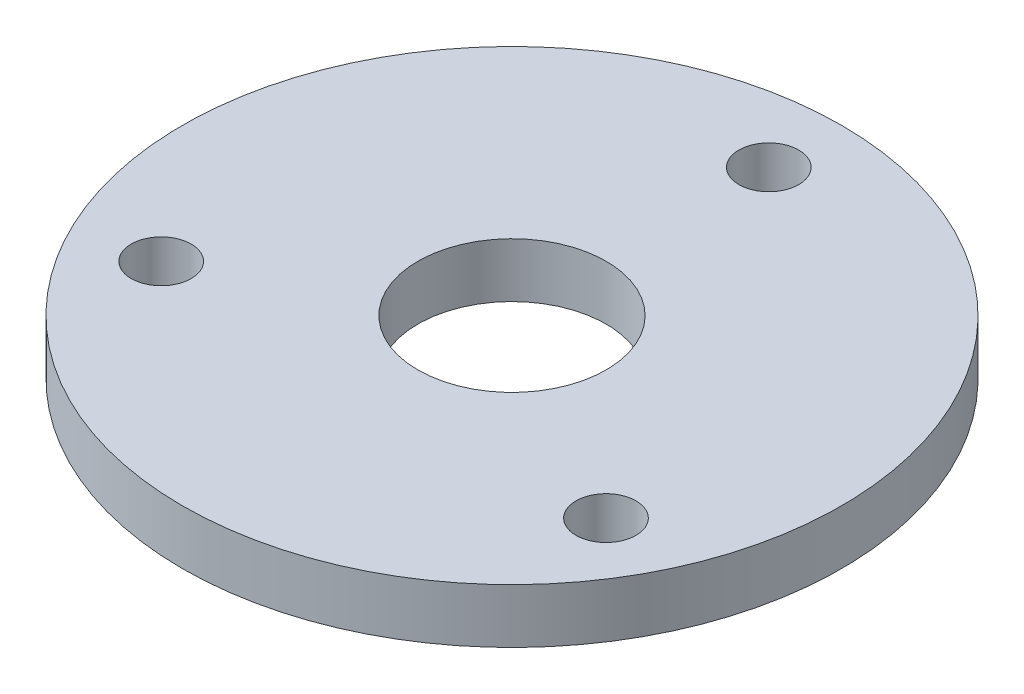
from build123d import *

# Parameters (mm, degrees)
SKETCH5_R           = 38.5
BOSS_EXTRUDE2_DEPTH = 6.36
SKETCH7_R           = 3.5
CUT_EXTRUDE3_DEPTH  = 1086.328407818
SKETCH8_R           = 11
CUT_EXTRUDE4_DEPTH  = 1086.328407818


with BuildPart() as part:
    # Sketch5 → Boss-Extrude2 (new body)
    with BuildSketch(Plane(origin=(0, 0, 0), x_dir=(1, 0, 0), z_dir=(0, 1, 0))):
        with Locations(Location((933.152542373, 445.016949153, 0), (0, 0, 90))):
            Circle(SKETCH5_R)
    extrude(amount=BOSS_EXTRUDE2_DEPTH)

    # Sketch7 → Cut-Extrude3 (cut, through all)
    with BuildSketch(Plane(origin=(0, 6.36, 0), x_dir=(1, 0, 0), z_dir=(0, 1, 0))):
        with Locations(Location((933.152542373, 475.016949153, 0), (0, 0, 270))):
            Circle(SKETCH7_R)
        with Locations((-55.199525992, -1045.642281877)):
            Circle(SKETCH7_R)
        with Locations((-877.953016381, 570.625332725)):
            Circle(SKETCH7_R)
        with Locations(Location((959.133304486, 430.016949153, 0), (0, 0, 270))):
            Circle(SKETCH7_R)
        with Locations(Location((907.171780259, 430.016949153, 0), (0, 0, 270))):
            Circle(SKETCH7_R)
    extrude(amount=-CUT_EXTRUDE3_DEPTH, mode=Mode.SUBTRACT)

    # Sketch8 → Cut-Extrude4 (cut, through all)
    with BuildSketch(Plane(origin=(0, 6.36, 0), x_dir=(1, 0, 0), z_dir=(0, 1, 0))):
        with Locations(Location((933.152542373, 445.016949153, 0), (0, 0, 270))):
            Circle(SKETCH8_R)
    extrude(amount=-CUT_EXTRUDE4_DEPTH, mode=Mode.SUBTRACT)


solid = part.part
